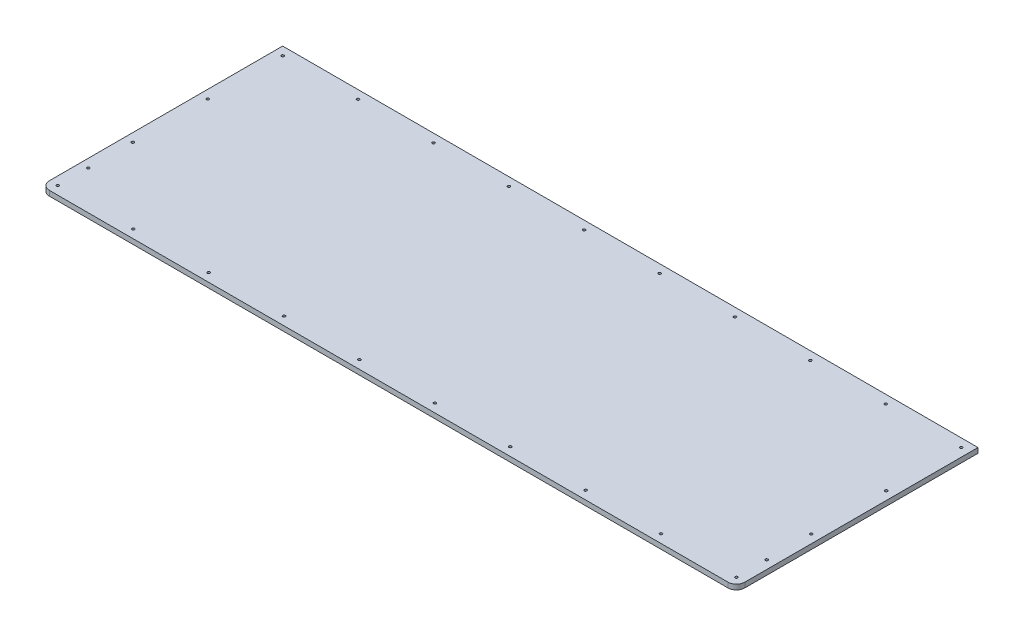
from build123d import *

# Parameters (mm, degrees)
DODANIE_WYCI_GNI_CIE1_DEPTH = 6
SZKIC3_R                    = 1.55
WYTNIJ_WYCI_GNI_CIE1_DEPTH  = 6
SZYK_LINIOWY1_COUNT         = 2
SZYK_LINIOWY1_PITCH         = 36
SZYK_LINIOWY1_COL_COUNT     = 4
SZYK_LINIOWY1_COL_PITCH     = 89
SZYK_LINIOWY2_COUNT         = 9
SZYK_LINIOWY2_PITCH         = 89.555
SZKIC4_R                    = 1.55
WYTNIJ_WYCI_GNI_CIE2_DEPTH  = 6
SZYK_LINIOWY3_COUNT         = 9
SZYK_LINIOWY3_PITCH         = 89.555
SZYK_LINIOWY3_COL_COUNT     = 4
SZYK_LINIOWY3_COL_PITCH     = 89
SZYK_LINIOWY4_COUNT         = 2
SZYK_LINIOWY4_PITCH         = 231


with BuildPart() as part:
    # Szkic2 → Dodanie-wyciągnięcie1 (new body)
    with BuildSketch(Plane.ZX.offset(1505.947389818)):
        with BuildLine():
            Line((-189.955224703, 667.685033185), (-189.955224703, -158.314966815))
            Line((-189.955224703, -158.314966815), (87.044775297, -158.314966815))
            ThreePointArc((87.044775297, -158.314966815), (94.115843109, -155.386034627), (97.044775297, -148.314966815))
            Line((97.044775297, -148.314966815), (97.044775297, 657.685033185))
            ThreePointArc((97.044775297, 657.685033185), (94.115843109, 664.756100997), (87.044775297, 667.685033185))
            Line((87.044775297, 667.685033185), (-189.955224703, 667.685033185))
        make_face()
    extrude(amount=DODANIE_WYCI_GNI_CIE1_DEPTH)

    # Szkic3 → Wytnij-wyciągnięcie1 (cut)
    with BuildSketch(Plane.XZ.offset(-1505.947389818)):
        with Locations(Location((-148.314966815, 87.044775297, 0), (0, 0, 270))):
            Circle(SZKIC3_R)
    wytnij_wyci_gni_cie1 = extrude(amount=-WYTNIJ_WYCI_GNI_CIE1_DEPTH, mode=Mode.SUBTRACT)

    # Szyk liniowy1: Wytnij-wyciągnięcie1 ×2
    with Locations(*[(0, 0, -i * SZYK_LINIOWY1_PITCH) for i in range(1, SZYK_LINIOWY1_COUNT)]):
        add(wytnij_wyci_gni_cie1, mode=Mode.SUBTRACT)

    # Szyk liniowy1 col: Wytnij-wyciągnięcie1 ×4
    with Locations(*[(0, 0, -i * SZYK_LINIOWY1_COL_PITCH) for i in range(1, SZYK_LINIOWY1_COL_COUNT)]):
        add(wytnij_wyci_gni_cie1, mode=Mode.SUBTRACT)

    # Szyk liniowy2: Wytnij-wyciągnięcie1 ×9
    with Locations(*[(i * SZYK_LINIOWY2_PITCH, 0, 0) for i in range(1, SZYK_LINIOWY2_COUNT)]):
        add(wytnij_wyci_gni_cie1, mode=Mode.SUBTRACT)

    # Szkic4 → Wytnij-wyciągnięcie2 (cut)
    with BuildSketch(Plane.XZ.offset(-1505.947389818)):
        with Locations(Location((657.685033185, -179.955224703, 0), (0, 0, 270))):
            Circle(SZKIC4_R)
    wytnij_wyci_gni_cie2 = extrude(amount=-WYTNIJ_WYCI_GNI_CIE2_DEPTH, mode=Mode.SUBTRACT)

    # Szyk liniowy3: Wytnij-wyciągnięcie2 ×9
    with Locations(*[(-i * SZYK_LINIOWY3_PITCH, 0, 0) for i in range(1, SZYK_LINIOWY3_COUNT)]):
        add(wytnij_wyci_gni_cie2, mode=Mode.SUBTRACT)

    # Szyk liniowy3 col: Wytnij-wyciągnięcie2 ×4
    with Locations(*[(0, 0, i * SZYK_LINIOWY3_COL_PITCH) for i in range(1, SZYK_LINIOWY3_COL_COUNT)]):
        add(wytnij_wyci_gni_cie2, mode=Mode.SUBTRACT)

    # Szyk liniowy4: Wytnij-wyciągnięcie2 ×2
    with Locations(*[(0, 0, i * SZYK_LINIOWY4_PITCH) for i in range(1, SZYK_LINIOWY4_COUNT)]):
        add(wytnij_wyci_gni_cie2, mode=Mode.SUBTRACT)


solid = part.part
